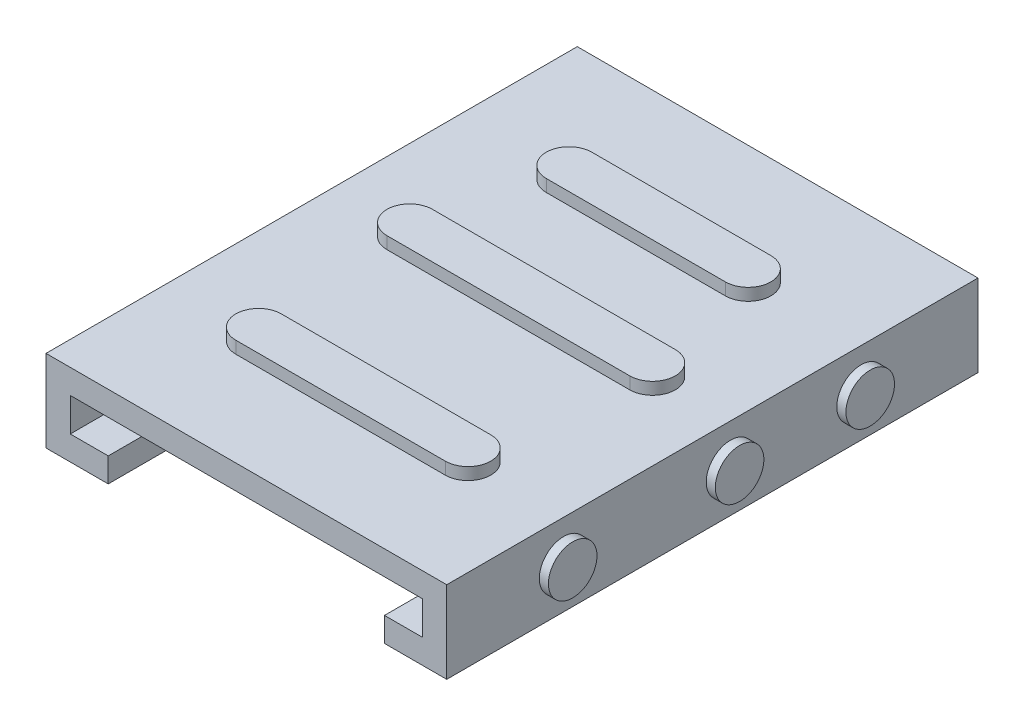
from build123d import *

# Parameters (mm, degrees)
BOSS_EXTRUDE1_DEPTH = 35
BOSS_EXTRUDE2_DEPTH = 0.8
SKETCH3_R           = 1.5
BOSS_EXTRUDE3_DEPTH = 0.6
SKETCH5_R           = 1.6
BOSS_EXTRUDE4_DEPTH = 0.6
SKETCH6_W           = 1.996397696
SKETCH6_H           = 1.346407749
SKETCH6_H_2         = 1.346407748
SKETCH6_W_2         = 2.042825549
BOSS_EXTRUDE5_DEPTH = 0.6


with BuildPart() as part:
    # Sketch1 → Boss-Extrude1 (new body)
    with BuildSketch(Plane.XY):
        Polygon((-59.84066795, 5.661190292), (-59.84066795, 7.261190292), (-62.34066795, 7.261190292), (-62.34066795, 9.461190292), (-39.14066795, 9.461190292), (-39.14066795, 7.261190292), (-41.64066795, 7.261190292), (-41.64066795, 5.661190292), (-37.54066795, 5.661190292), (-37.54066795, 11.061190292), (-63.94066795, 11.061190292), (-63.94066795, 5.661190292), align=None)
    extrude(amount=BOSS_EXTRUDE1_DEPTH)

    # Sketch2 → Boss-Extrude2 (add)
    with BuildSketch(Plane(origin=(0, 11.061190292, 0), x_dir=(1, 0, 0), z_dir=(0, 1, 0))):
        with BuildLine():
            Line((-56.64066795, -9.343006494), (-44.84066795, -9.343006494))
            ThreePointArc((-44.84066795, -9.343006494), (-43.34066795, -7.843006494), (-44.84066795, -6.343006494))
            Line((-44.84066795, -6.343006494), (-56.64066795, -6.343006494))
            ThreePointArc((-56.64066795, -6.343006494), (-58.14066795, -7.843006494), (-56.64066795, -9.343006494))
        make_face()
        with BuildLine():
            Line((-58.626258735, -17.853612356), (-42.626258735, -17.853612356))
            ThreePointArc((-42.626258735, -17.853612356), (-41.126258735, -16.353612356), (-42.626258735, -14.853612356))
            Line((-42.626258735, -14.853612356), (-58.626258735, -14.853612356))
            ThreePointArc((-58.626258735, -14.853612356), (-60.126258735, -16.353612356), (-58.626258735, -17.853612356))
        make_face()
        with BuildLine():
            Line((-57.64066795, -28.796277067), (-43.84066795, -28.796277067))
            ThreePointArc((-43.84066795, -28.796277067), (-42.34066795, -27.296277067), (-43.84066795, -25.796277067))
            Line((-43.84066795, -25.796277067), (-57.64066795, -25.796277067))
            ThreePointArc((-57.64066795, -25.796277067), (-59.14066795, -27.296277067), (-57.64066795, -28.796277067))
        make_face()
    extrude(amount=BOSS_EXTRUDE2_DEPTH)

    # Sketch3 → Boss-Extrude3 (add)
    with BuildSketch(Plane.ZY.offset(63.94066795)):
        with Locations((7.526452948, 8.361190292)):
            Circle(SKETCH3_R)
        with Locations((16.495470081, 8.361190292)):
            Circle(SKETCH3_R)
        with Locations((27.258290641, 8.361190292)):
            Circle(SKETCH3_R)
    extrude(amount=BOSS_EXTRUDE3_DEPTH)

    # Sketch5 → Boss-Extrude4 (add)
    with BuildSketch(Plane(origin=(-37.54066795, 0, 0), x_dir=(0, 0, -1), z_dir=(1, 0, 0))):
        with Locations((-27.301707085, 8.361190292)):
            Circle(SKETCH5_R)
        with Locations((-16.305217257, 8.361190292)):
            Circle(SKETCH5_R)
        with Locations((-7.70148216, 8.361190292)):
            Circle(SKETCH5_R)
    extrude(amount=BOSS_EXTRUDE4_DEPTH)

    # Sketch6 → Boss-Extrude5 (add)
    with BuildSketch(Plane.XZ.offset(-5.661190292)):
        with Locations((-39.381913502, 23.535620941)):
            Rectangle(SKETCH6_W, SKETCH6_H)
        with Locations((-61.713710985, 23.883829842)):
            Rectangle(SKETCH6_W, SKETCH6_H_2)
        with Locations((-61.713710985, 19.008905236)):
            Rectangle(SKETCH6_W, SKETCH6_H)
        with Locations((-61.713710985, 13.576846388)):
            Rectangle(SKETCH6_W, SKETCH6_H_2)
        with Locations((-61.690497059, 9.584050996)):
            Rectangle(SKETCH6_W_2, SKETCH6_H_2)
        with Locations((-39.381913502, 18.660696335)):
            Rectangle(SKETCH6_W, SKETCH6_H_2)
        with Locations((-39.381913502, 13.228637488)):
            Rectangle(SKETCH6_W, SKETCH6_H)
        with Locations((-39.358699576, 9.235842096)):
            Rectangle(SKETCH6_W_2, SKETCH6_H)
    extrude(amount=BOSS_EXTRUDE5_DEPTH)


solid = part.part
